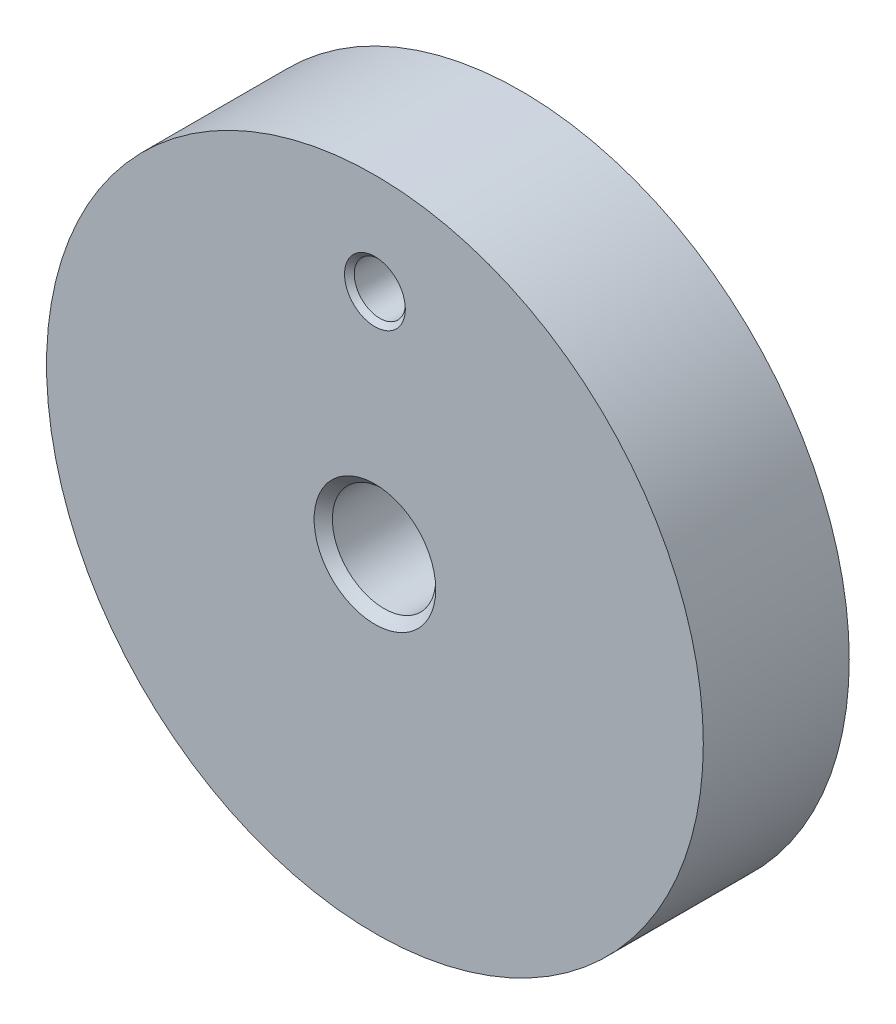
from build123d import *

# Parameters (mm, degrees)
SKETCH1_R           = 27
BOSS_EXTRUDE1_DEPTH = 12


with BuildPart() as part:
    # Sketch1 → Boss-Extrude1 (new body)
    with BuildSketch(Plane.XY):
        Circle(SKETCH1_R)
    extrude(amount=BOSS_EXTRUDE1_DEPTH)

    # Sketch8 → M10 Tapped Hole2 (revolve, cut)
    with BuildSketch(Plane(origin=(0, 0, 12), x_dir=(0, -1, 0), z_dir=(1, 0, 0))):
        Polygon((0, 0), (0, 12), (5, 12), (4.25, 11.25), (4.25, 0.75), (5, 0), align=None)
    revolve(axis=Axis((0, 0, 18.35), (0, 0, -1)), mode=Mode.SUBTRACT)

    # Sketch9 → M5 Tapped Hole1 (revolve, cut)
    with BuildSketch(Plane(origin=(0, 18.69698963, 12), x_dir=(0, -1, 0), z_dir=(1, 0, 0))):
        Polygon((0, 0), (0, 12), (2.5, 12), (2.1, 11.6), (2.1, 0.4), (2.5, 0), align=None)
    revolve(axis=Axis((0, 18.69698963, 18.35), (0, 0, -1)), mode=Mode.SUBTRACT)


solid = part.part
